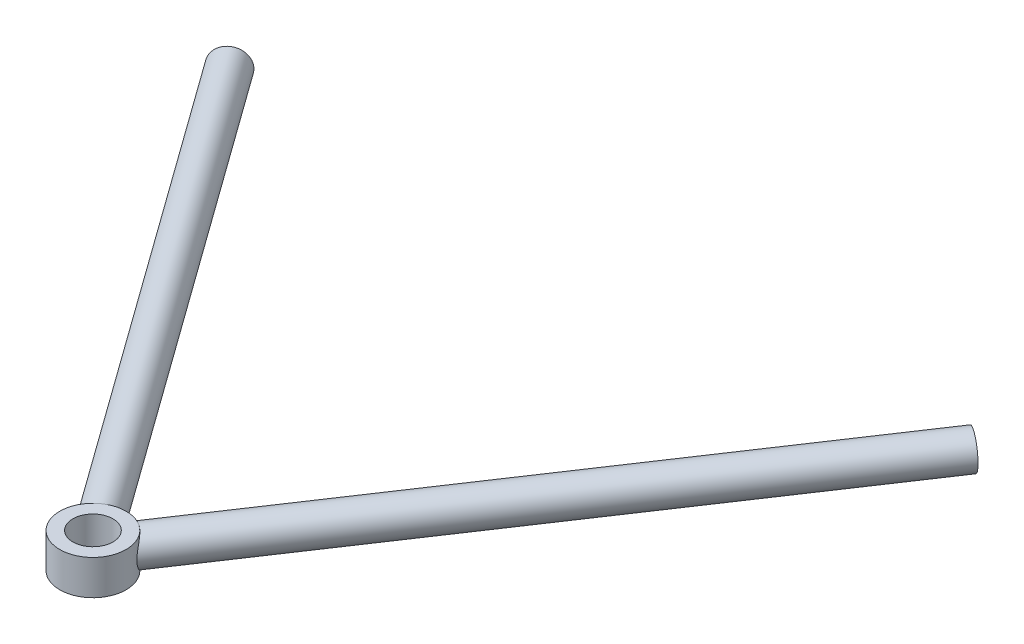
from build123d import *

# Parameters (mm, degrees)
SKETCH1_R                = 19.0062
SKETCH1_R_2              = 11.5062
BOSS_EXTRUDE1_DEPTH      = 10
BOSS_EXTRUDE2_REACH      = 392.082
BOSS_EXTRUDE2_END_RADIUS = 19.0062
SKETCH5_R                = 10
SKETCH5_R_2              = 7
BOSS_EXTRUDE3_REACH      = 510.057
BOSS_EXTRUDE3_END_RADIUS = 19.0062
SKETCH6_R                = 10
SKETCH6_R_2              = 7


with BuildPart() as part:
    # Sketch1 → Boss-Extrude1 (new, symmetric)
    with BuildSketch(Plane(origin=(0, 0, 0), x_dir=(1, 0, 0), z_dir=(0, 1, 0))):
        with Locations(Location((0, 0, 0), (0, 0, 270))):
            Circle(SKETCH1_R)
        with Locations(Location((0, 0, 0), (0, 0, 270))):
            Circle(SKETCH1_R_2, mode=Mode.SUBTRACT)
    extrude(amount=BOSS_EXTRUDE1_DEPTH, both=True)

    # Boss-Extrude2: up to this cylinder (the profile starts outside it)
    boss_extrude2_end = Plane(origin=(0, 0, 0), z_dir=(0, -1, 0)) * Cylinder(BOSS_EXTRUDE2_END_RADIUS, 823.1764, mode=Mode.PRIVATE)
    # Sketch5 → Boss-Extrude2 (add, up to the surface)
    with BuildSketch(Plane(origin=(201.884851726, 0, -302.352155823), x_dir=(0.8316479627965052, 0, 0.555303219850581), z_dir=(0.555303219850581, 0, -0.8316479627965052)), mode=Mode.PRIVATE) as boss_extrude2_sk1:
        with Locations(Location((0, 0, 0), (0, 0, 180))):
            Circle(SKETCH5_R)
        with Locations(Location((0, 0, 0), (0, 0, 180))):
            Circle(SKETCH5_R_2, mode=Mode.SUBTRACT)
    boss_extrude2_tool1 = extrude(boss_extrude2_sk1.sketch, amount=-BOSS_EXTRUDE2_REACH, mode=Mode.PRIVATE) - boss_extrude2_end
    add(boss_extrude2_tool1.solids().sort_by_distance((209.966106, 0, -296.956187))[0])

    # Boss-Extrude3: up to this cylinder (the profile starts outside it)
    boss_extrude3_end = Plane(origin=(0, 0, 0), z_dir=(0, -1, 0)) * Cylinder(BOSS_EXTRUDE3_END_RADIUS, 1059.1264, mode=Mode.PRIVATE)
    # Sketch6 → Boss-Extrude3 (add, up to the surface)
    with BuildSketch(Plane(origin=(-200.97050419, 0, -279.254437795), x_dir=(-0.811662071535183, 0, 0.5841272820466578), z_dir=(-0.5841272820466578, 0, -0.811662071535183)), mode=Mode.PRIVATE) as boss_extrude3_sk1:
        Circle(SKETCH6_R)
        Circle(SKETCH6_R_2, mode=Mode.SUBTRACT)
    boss_extrude3_tool1 = extrude(boss_extrude3_sk1.sketch, amount=-BOSS_EXTRUDE3_REACH, mode=Mode.PRIVATE) - boss_extrude3_end
    add(boss_extrude3_tool1.solids().sort_by_distance((-193.083456, 0, -284.930494))[0])


solid = part.part
